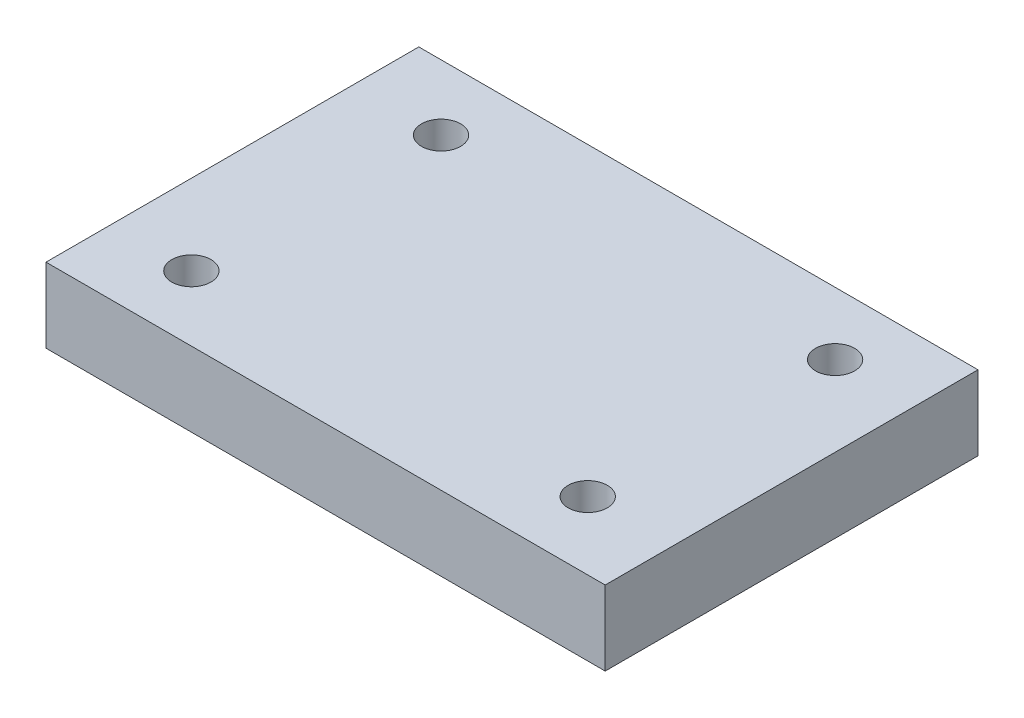
from build123d import *

# Parameters (mm, degrees)
SKETCH1_W           = 30
SKETCH1_H           = 20
BOSS_EXTRUDE1_DEPTH = 4
SKETCH2_R           = 1.05
CUT_EXTRUDE2_DEPTH  = 10


with BuildPart() as part:
    # Sketch1 → Boss-Extrude1 (new body)
    with BuildSketch(Plane(origin=(0, 0, 0), x_dir=(1, 0, 0), z_dir=(0, 1, 0))):
        with Locations((15, 10)):
            Rectangle(SKETCH1_W, SKETCH1_H)
    extrude(amount=BOSS_EXTRUDE1_DEPTH)

    # Sketch2 → Cut-Extrude2 (cut)
    with BuildSketch(Plane(origin=(0, 4, 0), x_dir=(1, 0, 0), z_dir=(0, 1, 0))):
        with Locations(Location((4.693652707, 16.5, 0), (0, 0, 270))):
            Circle(SKETCH2_R)
        with Locations(Location((25.693652707, 16.639179862, 0), (0, 0, 270))):
            Circle(SKETCH2_R)
        with Locations(Location((4.302512115, 3.496642024, 0), (0, 0, 270))):
            Circle(SKETCH2_R)
        with Locations(Location((25.423210771, 3.639179862, 0), (0, 0, 270))):
            Circle(SKETCH2_R)
    extrude(amount=-CUT_EXTRUDE2_DEPTH, mode=Mode.SUBTRACT)


solid = part.part
